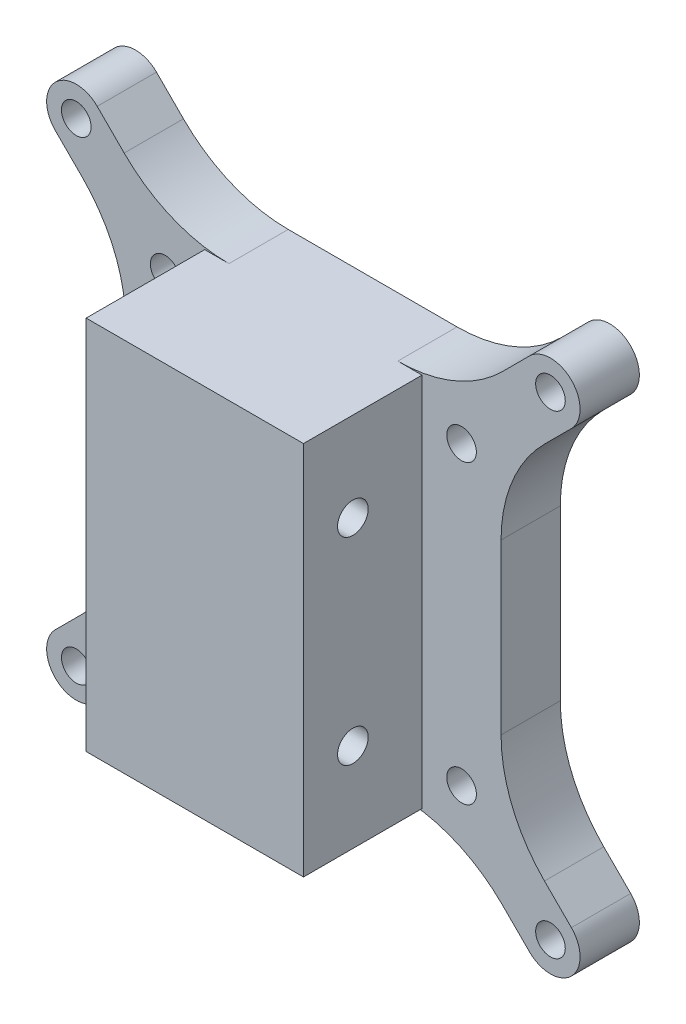
from build123d import *

# Parameters (mm, degrees)
SKETCH2_R               = 1.5
BOSS_EXTRUDE2_DEPTH     = 6
SKETCH3_W               = 22
SKETCH3_H               = 38
BOSS_EXTRUDE3_DEPTH     = 12
CUT_EXTRUDE1_DEPTH      = 50.969990995
CUT_EXTRUDE1_DEPTH_BACK = 50.969990995
SKETCH5_R               = 1.55


with BuildPart() as part:
    # Sketch2 → Boss-Extrude2 (new body)
    with BuildSketch(Plane.XY):
        with BuildLine():
            Line((8.544155877, 19), (-8.544155877, 19))
            ThreePointArc((-8.544155877, 19), (-14.284407363, 20.141807012), (-19.150757595, 23.393398282))
            Line((-19.150757595, 23.393398282), (-21.878679656, 26.121320344))
            ThreePointArc((-21.878679656, 26.121320344), (-26.121320344, 26.121320344), (-26.121320344, 21.878679656))
            Line((-26.121320344, 21.878679656), (-23.393398282, 19.150757595))
            ThreePointArc((-23.393398282, 19.150757595), (-20.141807012, 14.284407363), (-19, 8.544155877))
            Line((-19, 8.544155877), (-19, -8.544155877))
            ThreePointArc((-19, -8.544155877), (-20.141807012, -14.284407363), (-23.393398282, -19.150757595))
            Line((-23.393398282, -19.150757595), (-26.121320344, -21.878679656))
            ThreePointArc((-26.121320344, -21.878679656), (-26.121320344, -26.121320344), (-21.878679656, -26.121320344))
            Line((-21.878679656, -26.121320344), (-19.150757595, -23.393398282))
            ThreePointArc((-19.150757595, -23.393398282), (-14.284407363, -20.141807012), (-8.544155877, -19))
            Line((-8.544155877, -19), (8.544155877, -19))
            ThreePointArc((8.544155877, -19), (14.284407363, -20.141807012), (19.150757595, -23.393398282))
            Line((19.150757595, -23.393398282), (21.878679656, -26.121320344))
            ThreePointArc((21.878679656, -26.121320344), (26.121320344, -26.121320344), (26.121320344, -21.878679656))
            Line((26.121320344, -21.878679656), (23.393398282, -19.150757595))
            ThreePointArc((23.393398282, -19.150757595), (20.141807012, -14.284407363), (19, -8.544155877))
            Line((19, -8.544155877), (19, 8.544155877))
            ThreePointArc((19, 8.544155877), (20.141807012, 14.284407363), (23.393398282, 19.150757595))
            Line((23.393398282, 19.150757595), (26.121320344, 21.878679656))
            ThreePointArc((26.121320344, 21.878679656), (26.121320344, 26.121320344), (21.878679656, 26.121320344))
            Line((21.878679656, 26.121320344), (19.150757595, 23.393398282))
            ThreePointArc((19.150757595, 23.393398282), (14.284407363, 20.141807012), (8.544155877, 19))
        make_face()
        with Locations((15, 15)):
            Circle(SKETCH2_R, mode=Mode.SUBTRACT)
        with Locations((24, 24)):
            Circle(SKETCH2_R, mode=Mode.SUBTRACT)
        with Locations((24, -24)):
            Circle(SKETCH2_R, mode=Mode.SUBTRACT)
        with Locations((15, -15)):
            Circle(SKETCH2_R, mode=Mode.SUBTRACT)
        with Locations((-24, -24)):
            Circle(SKETCH2_R, mode=Mode.SUBTRACT)
        with Locations((-15, -15)):
            Circle(SKETCH2_R, mode=Mode.SUBTRACT)
        with Locations((-24, 24)):
            Circle(SKETCH2_R, mode=Mode.SUBTRACT)
        with Locations((-15, 15)):
            Circle(SKETCH2_R, mode=Mode.SUBTRACT)
    extrude(amount=BOSS_EXTRUDE2_DEPTH)

    # Sketch3 → Boss-Extrude3 (add)
    with BuildSketch(Plane.XY.offset(6)):
        Rectangle(SKETCH3_W, SKETCH3_H)
    extrude(amount=BOSS_EXTRUDE3_DEPTH)

    # Sketch5 → Cut-Extrude1 (cut, two sides: drawn at the far end of the back side and taken through both)
    with BuildSketch(Plane.ZY.offset(11).offset(-CUT_EXTRUDE1_DEPTH_BACK)):
        with Locations((13, -10)):
            Circle(SKETCH5_R)
        with Locations((13, 10)):
            Circle(SKETCH5_R)
    extrude(amount=CUT_EXTRUDE1_DEPTH + CUT_EXTRUDE1_DEPTH_BACK, mode=Mode.SUBTRACT)


solid = part.part
